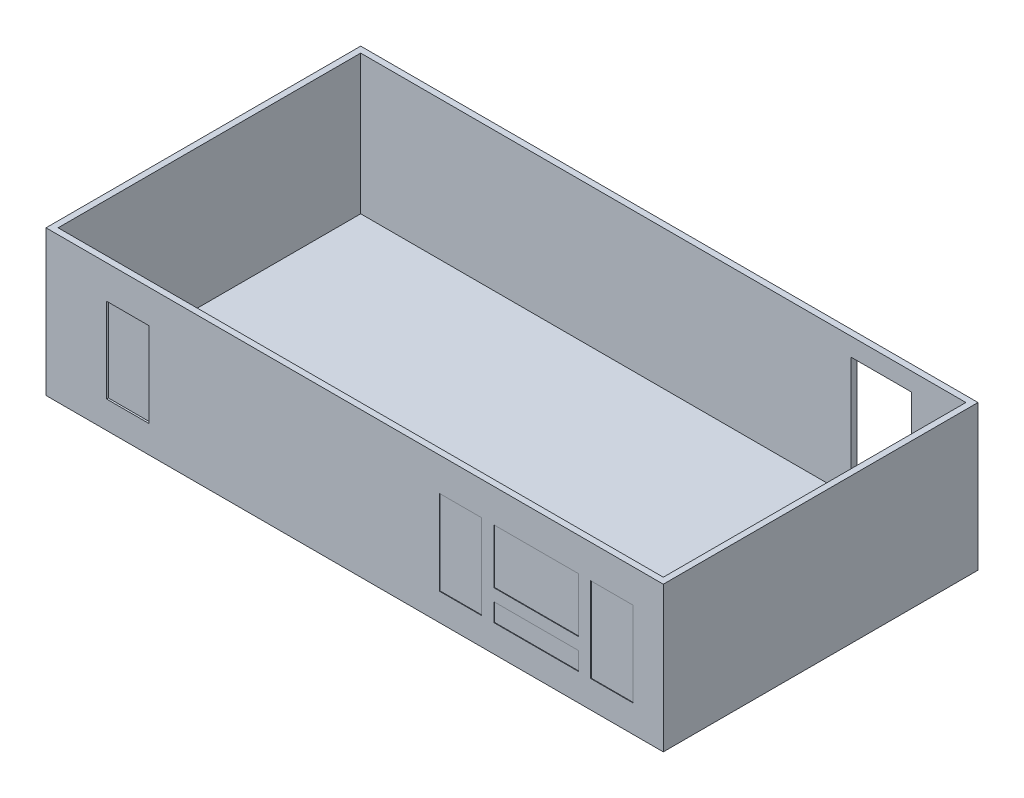
from build123d import *

# Parameters (mm, degrees)
SKETCH1_W           = 10200
SKETCH1_H           = 5200
SKETCH1_W_2         = 10000
SKETCH1_H_2         = 5000
BOSS_EXTRUDE1_DEPTH = 2300
SKETCH2_W           = 10200
SKETCH2_H           = 5200
BOSS_EXTRUDE2_DEPTH = 100
CUT_EXTRUDE1_REACH  = 11592.513
SKETCH3_W           = 700
SKETCH3_H           = 1400
SKETCH3_W_2         = 1400
SKETCH3_H_2         = 900
SKETCH3_H_3         = 300
SKETCH5_W           = 700
SKETCH5_H           = 1400
SKETCH5_W_2         = 1400
SKETCH5_H_2         = 900
SKETCH5_H_3         = 300
BOSS_EXTRUDE5_DEPTH = 20
CUT_EXTRUDE2_REACH  = 11592.513
SKETCH6_W           = 700
SKETCH6_H           = 1400
SKETCH7_W           = 700
SKETCH7_H           = 1400
BOSS_EXTRUDE6_DEPTH = 20
CUT_EXTRUDE3_REACH  = 11592.513
SKETCH8_W           = 1000
SKETCH8_H           = 2000


with BuildPart() as part:
    # Sketch1 → Boss-Extrude1 (new body)
    with BuildSketch(Plane(origin=(0, 0, 0), x_dir=(1, 0, 0), z_dir=(0, 1, 0))):
        with Locations((-5000, 2500)):
            Rectangle(SKETCH1_W, SKETCH1_H)
        with Locations((-5000, 2500)):
            Rectangle(SKETCH1_W_2, SKETCH1_H_2, mode=Mode.SUBTRACT)
    extrude(amount=BOSS_EXTRUDE1_DEPTH)

    # Sketch2 → Boss-Extrude2 (add)
    with BuildSketch(Plane(origin=(0, 0, 0), x_dir=(1, 0, 0), z_dir=(0, 1, 0))):
        with Locations((-5000, 2500)):
            Rectangle(SKETCH2_W, SKETCH2_H)
    extrude(amount=-BOSS_EXTRUDE2_DEPTH)

    # Sketch3 → Cut-Extrude1 (cut, up to next)
    with BuildSketch(Plane.XY.offset(100), mode=Mode.PRIVATE) as cut_extrude1_sk1:
        with Locations((-750, 1050)):
            Rectangle(SKETCH3_W, SKETCH3_H)
    cut_extrude1_tool1 = extrude(cut_extrude1_sk1.sketch, amount=-CUT_EXTRUDE1_REACH, mode=Mode.PRIVATE) & part.part
    # Sketch3 → Cut-Extrude1 (cut, up to next)
    with BuildSketch(Plane.XY.offset(100), mode=Mode.PRIVATE) as cut_extrude1_sk2:
        with Locations((-2000, 1300)):
            Rectangle(SKETCH3_W_2, SKETCH3_H_2)
    cut_extrude1_tool2 = extrude(cut_extrude1_sk2.sketch, amount=-CUT_EXTRUDE1_REACH, mode=Mode.PRIVATE) & part.part
    # Sketch3 → Cut-Extrude1 (cut, up to next)
    with BuildSketch(Plane.XY.offset(100), mode=Mode.PRIVATE) as cut_extrude1_sk3:
        with Locations((-2000, 500)):
            Rectangle(SKETCH3_W_2, SKETCH3_H_3)
    cut_extrude1_tool3 = extrude(cut_extrude1_sk3.sketch, amount=-CUT_EXTRUDE1_REACH, mode=Mode.PRIVATE) & part.part
    # Sketch3 → Cut-Extrude1 (cut, up to next)
    with BuildSketch(Plane.XY.offset(100), mode=Mode.PRIVATE) as cut_extrude1_sk4:
        with Locations((-3250, 1050)):
            Rectangle(SKETCH3_W, SKETCH3_H)
    cut_extrude1_tool4 = extrude(cut_extrude1_sk4.sketch, amount=-CUT_EXTRUDE1_REACH, mode=Mode.PRIVATE) & part.part
    add(cut_extrude1_tool1.solids().sort_by_distance((-750, 1050, 100))[0], mode=Mode.SUBTRACT)
    add(cut_extrude1_tool2.solids().sort_by_distance((-2000, 1300, 100))[0], mode=Mode.SUBTRACT)
    add(cut_extrude1_tool3.solids().sort_by_distance((-2000, 500, 100))[0], mode=Mode.SUBTRACT)
    add(cut_extrude1_tool4.solids().sort_by_distance((-3250, 1050, 100))[0], mode=Mode.SUBTRACT)

    # Sketch5 → Boss-Extrude5 (add)
    with BuildSketch(Plane.XY.offset(70)):
        with Locations((-3250, 1050)):
            Rectangle(SKETCH5_W, SKETCH5_H)
        with Locations((-2000, 1300)):
            Rectangle(SKETCH5_W_2, SKETCH5_H_2)
        with Locations((-2000, 500)):
            Rectangle(SKETCH5_W_2, SKETCH5_H_3)
        with Locations((-750, 1050)):
            Rectangle(SKETCH5_W, SKETCH5_H)
    extrude(amount=BOSS_EXTRUDE5_DEPTH)

    # Sketch6 → Cut-Extrude2 (cut, up to next)
    with BuildSketch(Plane.XY.offset(100), mode=Mode.PRIVATE) as cut_extrude2_sk1:
        with Locations((-8750, 1050)):
            Rectangle(SKETCH6_W, SKETCH6_H)
    cut_extrude2_tool1 = extrude(cut_extrude2_sk1.sketch, amount=-CUT_EXTRUDE2_REACH, mode=Mode.PRIVATE) & part.part
    add(cut_extrude2_tool1.solids().sort_by_distance((-8750, 1050, 100))[0], mode=Mode.SUBTRACT)

    # Sketch7 → Boss-Extrude6 (add)
    with BuildSketch(Plane.XY.offset(70)):
        with Locations((-8750, 1050)):
            Rectangle(SKETCH7_W, SKETCH7_H)
    extrude(amount=-BOSS_EXTRUDE6_DEPTH)

    # Sketch8 → Cut-Extrude3 (cut, up to next)
    with BuildSketch(Plane(origin=(0, 0, -5100), x_dir=(-1, 0, 0), z_dir=(0, 0, -1)), mode=Mode.PRIVATE) as cut_extrude3_sk1:
        with Locations((1400, 1000)):
            Rectangle(SKETCH8_W, SKETCH8_H)
    cut_extrude3_tool1 = extrude(cut_extrude3_sk1.sketch, amount=-CUT_EXTRUDE3_REACH, mode=Mode.PRIVATE) & part.part
    add(cut_extrude3_tool1.solids().sort_by_distance((-1400, 1000, -5100))[0], mode=Mode.SUBTRACT)


solid = part.part
